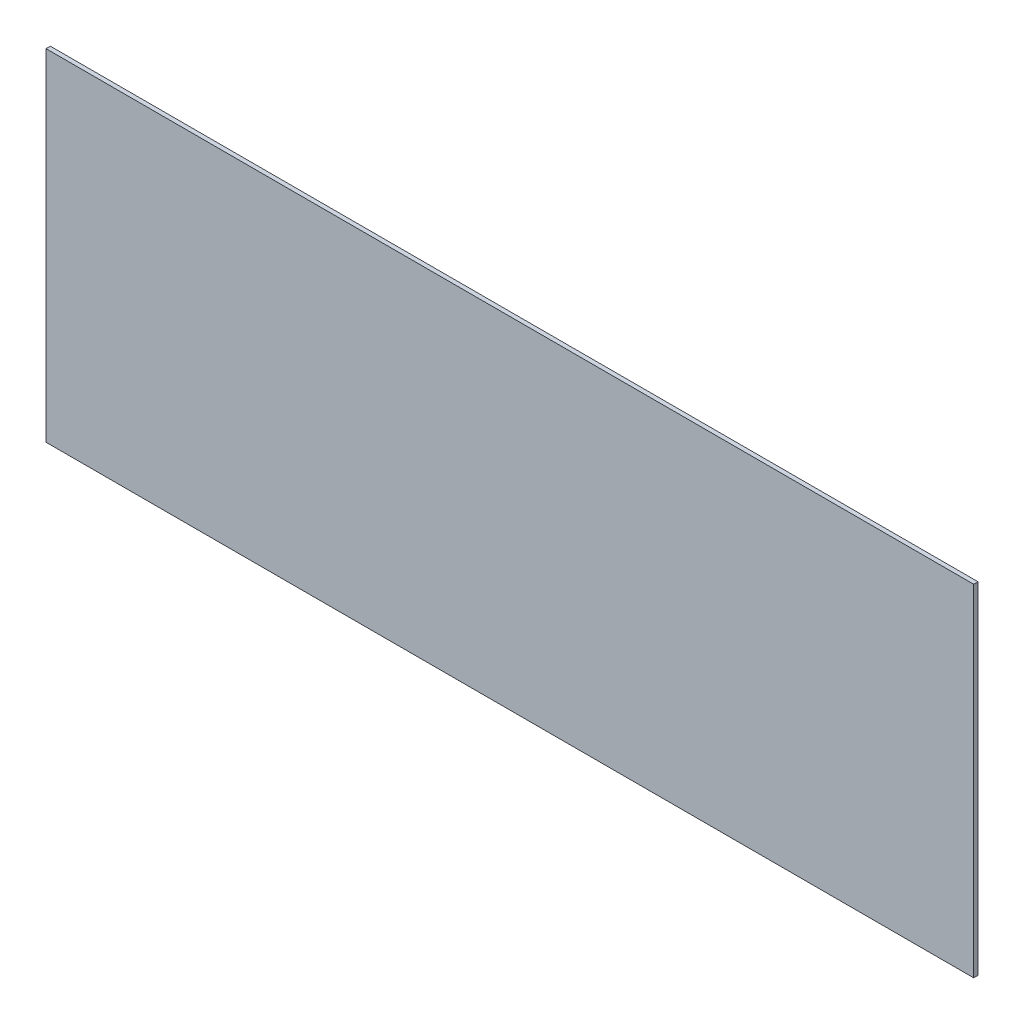
from build123d import *

# Parameters (mm, degrees)
SKETCH2_W           = 430
SKETCH2_H           = 158.007190314
BOSS_EXTRUDE1_DEPTH = 2


with BuildPart() as part:
    # Sketch2 → Boss-Extrude1 (new body)
    with BuildSketch(Plane.XY):
        with Locations((205.475, 60)):
            Rectangle(SKETCH2_W, SKETCH2_H)
    extrude(amount=BOSS_EXTRUDE1_DEPTH)


solid = part.part
